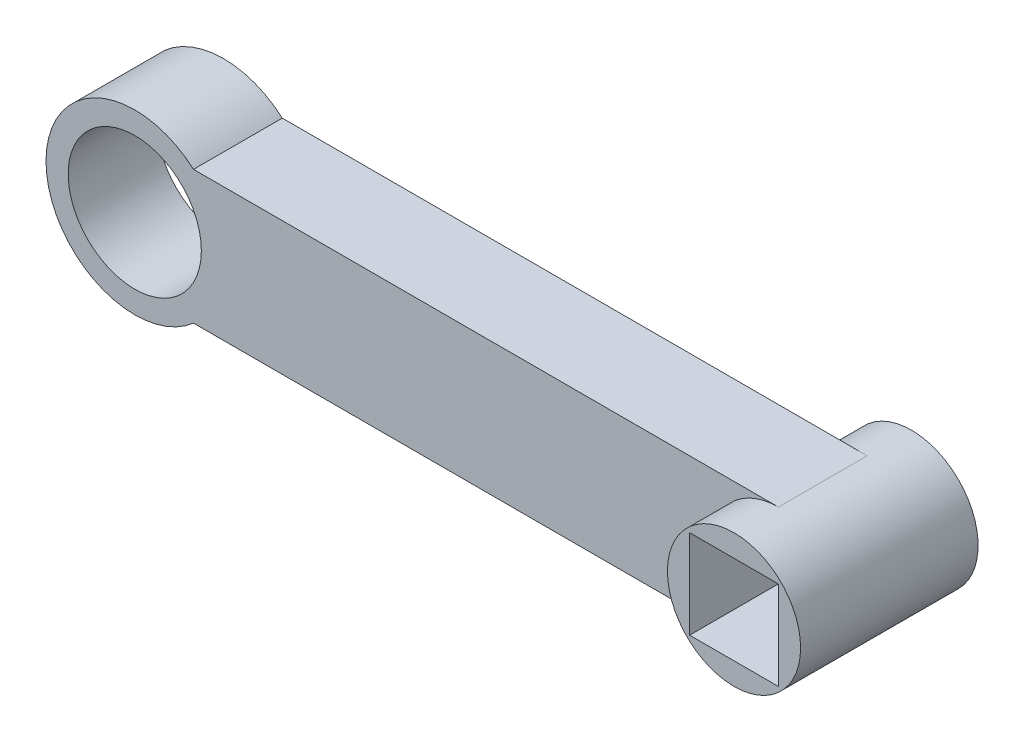
from build123d import *

# Parameters (mm, degrees)
SKETCH1_R           = 15
BOSS_EXTRUDE2_DEPTH = 20
SKETCH3_R           = 15
BOSS_EXTRUDE3_DEPTH = 10
BOSS_EXTRUDE4_START = 10
SKETCH5_R           = 15
BOSS_EXTRUDE4_DEPTH = 10
SKETCH6_W           = 20
SKETCH6_H           = 20
CUT_EXTRUDE1_DEPTH  = 50


with BuildPart() as part:
    # Sketch1 → Boss-Extrude2 (new body)
    with BuildSketch(Plane.XY):
        with BuildLine():
            Line((72.5, -15), (-59.271243445, -15))
            ThreePointArc((-59.271243445, -15), (-92.5, 0), (-59.271243445, 15))
            Line((-59.271243445, 15), (72.5, 15))
            ThreePointArc((72.5, 15), (87.5, 0), (72.5, -15))
        make_face()
        with Locations((-72.5, 0)):
            Circle(SKETCH1_R, mode=Mode.SUBTRACT)
    extrude(amount=BOSS_EXTRUDE2_DEPTH)

    # Sketch3 → Boss-Extrude3 (add)
    with BuildSketch(Plane.XY.offset(20)):
        with Locations(Location((72.5, 0, 0), (0, 0, 90))):
            Circle(SKETCH3_R)
    extrude(amount=BOSS_EXTRUDE3_DEPTH)

    # Sketch5 → Boss-Extrude4 (add)
    with BuildSketch(Plane(origin=(0, 0, 0), x_dir=(-1, 0, 0), z_dir=(0, 0, -1)).offset(BOSS_EXTRUDE4_START)):
        with Locations((-72.5, 0)):
            Circle(SKETCH5_R)
    extrude(amount=-BOSS_EXTRUDE4_DEPTH)

    # Sketch6 → Cut-Extrude1 (cut)
    with BuildSketch(Plane(origin=(0, 0, -10), x_dir=(-1, 0, 0), z_dir=(0, 0, -1))):
        with Locations((-72.5, 0)):
            Rectangle(SKETCH6_W, SKETCH6_H)
    extrude(amount=-CUT_EXTRUDE1_DEPTH, mode=Mode.SUBTRACT)


solid = part.part
